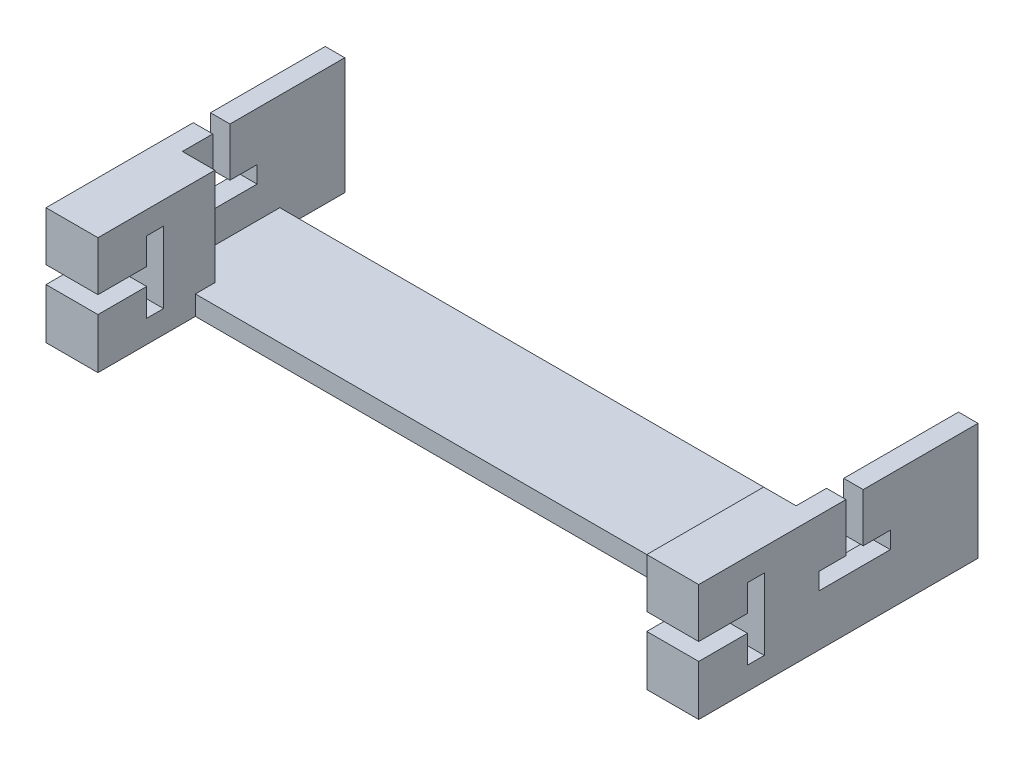
from build123d import *

# Parameters (mm, degrees)
SKETCH1_W           = 30
SKETCH1_H           = 30
BOSS_EXTRUDE1_DEPTH = 6
SKETCH2_W           = 30
SKETCH2_H           = 36
BOSS_EXTRUDE2_DEPTH = 6
SKETCH3_W           = 36
SKETCH3_H           = 36
BOSS_EXTRUDE3_DEPTH = 6
SKETCH4_W           = 36
SKETCH4_H           = 6
BOSS_EXTRUDE4_DEPTH = 165
SKETCH6_W           = 6
SKETCH6_H           = 30
BOSS_EXTRUDE6_DEPTH = 30
SKETCH9_W           = 6
SKETCH9_H           = 30
CUT_EXTRUDE2_DEPTH  = 20
SKETCH11_W          = 22
SKETCH11_H          = 5.2
SKETCH11_W_2        = 5.3
SKETCH11_H_2        = 15
CUT_EXTRUDE3_DEPTH  = 500
SKETCH13_W          = 16
SKETCH13_H          = 36
BOSS_EXTRUDE7_DEPTH = 30
SKETCH16_W          = 15
SKETCH16_H          = 5.3
CUT_EXTRUDE4_DEPTH  = 2090
SKETCH17_W          = 6
SKETCH17_H          = 36
BOSS_EXTRUDE8_DEPTH = 20


with BuildPart() as part:
    # Sketch1 → Boss-Extrude1 (new body)
    with BuildSketch(Plane(origin=(0, 0, 0), x_dir=(1, 0, 0), z_dir=(0, 1, 0))):
        with Locations((15, -15)):
            Rectangle(SKETCH1_W, SKETCH1_H)
    extrude(amount=BOSS_EXTRUDE1_DEPTH)

    # Sketch2 → Boss-Extrude2 (add)
    with BuildSketch(Plane(origin=(30, 0, 0), x_dir=(0, 0, -1), z_dir=(1, 0, 0))):
        with Locations((-15, 18)):
            Rectangle(SKETCH2_W, SKETCH2_H)
    extrude(amount=BOSS_EXTRUDE2_DEPTH)

    # Sketch3 → Boss-Extrude3 (add)
    with BuildSketch(Plane.XY.offset(30)):
        with Locations((18, 18)):
            Rectangle(SKETCH3_W, SKETCH3_H)
    extrude(amount=BOSS_EXTRUDE3_DEPTH)

    # Sketch4 → Boss-Extrude4 (add)
    with BuildSketch(Plane.ZY):
        with Locations((18, 3)):
            Rectangle(SKETCH4_W, SKETCH4_H)
    extrude(amount=BOSS_EXTRUDE4_DEPTH)

    # Sketch6 → Boss-Extrude6 (add)
    with BuildSketch(Plane(origin=(0, 6, 0), x_dir=(1, 0, 0), z_dir=(0, 1, 0))):
        Polygon((-165, -30), (-165, -36), (-149, -36), (-149, -30), (-159, -30), align=None)
        with Locations((-162, -15)):
            Rectangle(SKETCH6_W, SKETCH6_H)
    extrude(amount=BOSS_EXTRUDE6_DEPTH)

    # Sketch9 → Cut-Extrude2 (cut)
    with BuildSketch(Plane.ZY):
        with Locations((33, 21)):
            Rectangle(SKETCH9_W, SKETCH9_H)
    extrude(amount=-CUT_EXTRUDE2_DEPTH, mode=Mode.SUBTRACT)

    # Sketch11 → Cut-Extrude3 (cut)
    with BuildSketch(Plane(origin=(36, 0, 0), x_dir=(0, 0, -1), z_dir=(1, 0, 0))):
        with Locations((-18, 18.4)):
            Rectangle(SKETCH11_W, SKETCH11_H)
        with Locations((-18, 28.5)):
            Rectangle(SKETCH11_W_2, SKETCH11_H_2)
    extrude(amount=-CUT_EXTRUDE3_DEPTH, mode=Mode.SUBTRACT)

    # Sketch13 → Boss-Extrude7 (add)
    with BuildSketch(Plane.XY.offset(36)):
        with Locations((-157, 18)):
            Rectangle(SKETCH13_W, SKETCH13_H)
        with Locations((28, 18)):
            Rectangle(SKETCH13_W, SKETCH13_H)
    extrude(amount=BOSS_EXTRUDE7_DEPTH)

    # Sketch16 → Cut-Extrude4 (cut)
    with BuildSketch(Plane.ZY.offset(165)):
        Polygon((51, 15.5), (51, 20.8), (51, 29), (45.8, 29), (45.8, 7), (51, 7), align=None)
        with Locations((58.5, 18.15)):
            Rectangle(SKETCH16_W, SKETCH16_H)
    extrude(amount=-CUT_EXTRUDE4_DEPTH, mode=Mode.SUBTRACT)

    # Sketch17 → Boss-Extrude8 (add)
    with BuildSketch(Plane(origin=(0, 0, 0), x_dir=(-1, 0, 0), z_dir=(0, 0, -1))):
        Polygon((159, 6), (159, 0), (165, 0), (165, 36), (159, 36), align=None)
        with Locations((-33, 18)):
            Rectangle(SKETCH17_W, SKETCH17_H)
    extrude(amount=BOSS_EXTRUDE8_DEPTH)


solid = part.part
